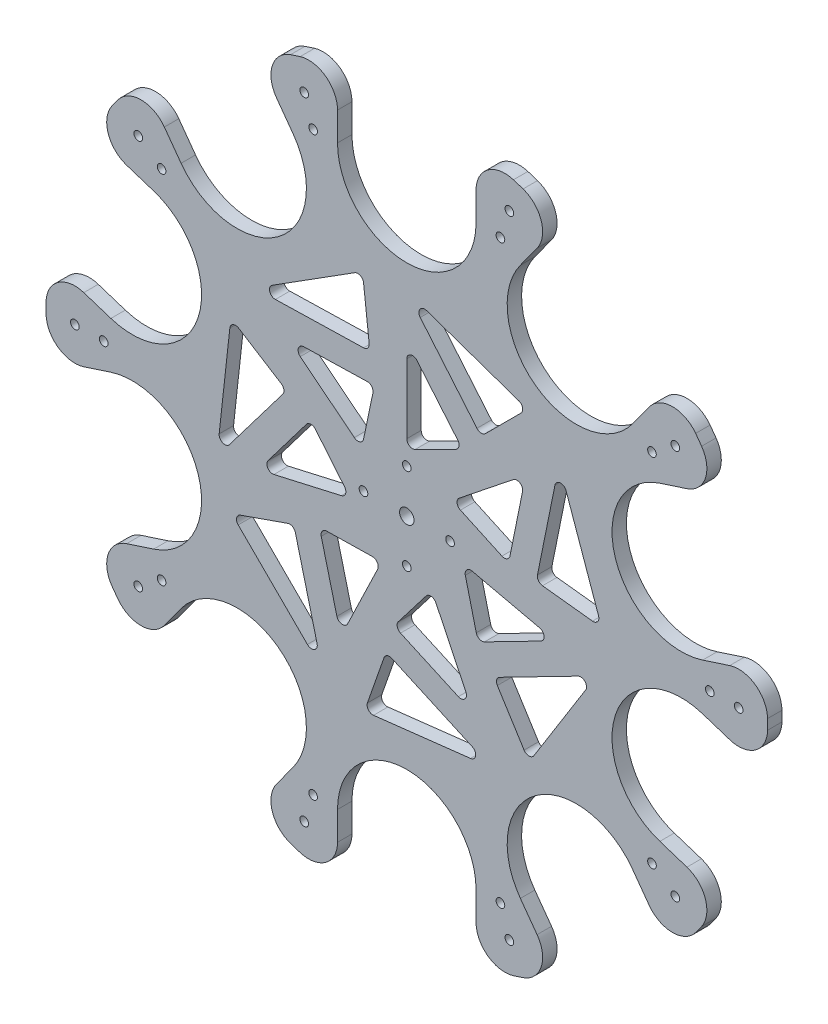
from build123d import *

# Parameters (mm, degrees)
EXTRUDE_1_DEPTH     = 5
CUT_EXTRUDE_2_DEPTH = 10


with BuildPart() as part:
    # 草图1 → 凸台-拉伸1 (new body)
    with BuildSketch(Plane.XY):
        with BuildLine():
            Line((-45.157092485, 102.984644478), (-39.362117364, 95.008545493))
            ThreePointArc((-39.362117364, 95.008545493), (-44.671679174, 61.485291572), (-78.194933094, 66.794853382))
            Line((-78.194933094, 66.794853382), (-83.989908215, 74.770952368))
            ThreePointArc((-83.989908215, 74.770952368), (-87.540173161, 77.803165087), (-92.080078159, 78.893099845))
            ThreePointArc((-92.080078159, 78.893099845), (-96.557407533, 77.83477316), (-100.087041477, 74.88380418))
            ThreePointArc((-100.087041477, 74.88380418), (-101.127124297, 73.473156537), (-102.147326663, 72.048064898))
            ThreePointArc((-102.147326663, 72.048064898), (-103.464208329, 63.127451833), (-97.065710474, 56.773654543))
            Line((-97.065710474, 56.773654543), (-87.689243765, 53.727055829))
            ThreePointArc((-87.689243765, 53.727055829), (-72.280295238, 23.485291572), (-102.522059495, 8.076343046))
            Line((-102.522059495, 8.076343046), (-111.898526204, 11.122941761))
            ThreePointArc((-111.898526204, 11.122941761), (-113.424351497, 11.489260004), (-114.988696148, 11.612376598))
            ThreePointArc((-114.988696148, 11.612376598), (-122.010018437, 8.732842405), (-124.987713204, 1.752583259))
            ThreePointArc((-124.987713204, 1.752583259), (-125, 0), (-124.987713204, -1.752583259))
            ThreePointArc((-124.987713204, -1.752583259), (-120.809688049, -9.743554451), (-111.898526204, -11.122941761))
            Line((-111.898526204, -11.122941761), (-102.522059495, -8.076343046))
            ThreePointArc((-102.522059495, -8.076343046), (-98.86007879, -7.197179263), (-95.10565163, -6.901699437))
            ThreePointArc((-95.10565163, -6.901699437), (-71.401131455, -27.147272277), (-87.689243765, -53.727055829))
            Line((-87.689243765, -53.727055829), (-97.065710474, -56.773654543))
            ThreePointArc((-97.065710474, -56.773654543), (-103.464208329, -63.127451833), (-102.147326663, -72.048064898))
            ThreePointArc((-102.147326663, -72.048064898), (-101.127124297, -73.473156537), (-100.087041477, -74.88380418))
            ThreePointArc((-100.087041477, -74.88380418), (-92.009973106, -78.892854106), (-83.989908215, -74.770952368))
            Line((-83.989908215, -74.770952368), (-78.194933094, -66.794853382))
            ThreePointArc((-78.194933094, -66.794853382), (-69.674297223, -59.517542857), (-58.778525229, -56.901699437))
            ThreePointArc((-58.778525229, -56.901699437), (-37.394368649, -70.005927444), (-39.362117364, -95.008545493))
            Line((-39.362117364, -95.008545493), (-45.157092485, -102.984644478))
            ThreePointArc((-45.157092485, -102.984644478), (-46.598917645, -111.88591714), (-40.290133197, -118.328801088))
            ThreePointArc((-40.290133197, -118.328801088), (-38.627124297, -118.882064537), (-36.956521739, -119.41195711))
            ThreePointArc((-36.956521739, -119.41195711), (-28.065575739, -117.907764962), (-24, -109.859000542))
            Line((-24, -109.859000542), (-24, -100))
            ThreePointArc((-24, -100), (-16.970562748, -83.029437252), (0, -76))
            ThreePointArc((0, -76), (16.970562748, -83.029437252), (24, -100))
            Line((24, -100), (24, -109.859000542))
            ThreePointArc((24, -109.859000542), (28.065575739, -117.907764962), (36.956521739, -119.41195711))
            ThreePointArc((36.956521739, -119.41195711), (38.627124297, -118.882064537), (40.290133197, -118.328801088))
            ThreePointArc((40.290133197, -118.328801088), (46.598917645, -111.88591714), (45.157092485, -102.984644478))
            Line((45.157092485, -102.984644478), (39.362117364, -95.008545493))
            ThreePointArc((39.362117364, -95.008545493), (37.394368649, -70.005927444), (58.778525229, -56.901699437))
            ThreePointArc((58.778525229, -56.901699437), (69.674297223, -59.517542857), (78.194933094, -66.794853382))
            Line((78.194933094, -66.794853382), (83.989908215, -74.770952368))
            ThreePointArc((83.989908215, -74.770952368), (92.009973106, -78.892854106), (100.087041477, -74.88380418))
            ThreePointArc((100.087041477, -74.88380418), (101.127124297, -73.473156537), (102.147326663, -72.048064898))
            ThreePointArc((102.147326663, -72.048064898), (103.464208329, -63.127451833), (97.065710474, -56.773654543))
            Line((97.065710474, -56.773654543), (87.689243765, -53.727055829))
            ThreePointArc((87.689243765, -53.727055829), (71.401131455, -27.147272277), (95.10565163, -6.901699437))
            ThreePointArc((95.10565163, -6.901699437), (98.86007879, -7.197179263), (102.522059495, -8.076343046))
            Line((102.522059495, -8.076343046), (111.898526204, -11.122941761))
            ThreePointArc((111.898526204, -11.122941761), (120.809688049, -9.743554451), (124.987713204, -1.752583259))
            ThreePointArc((124.987713204, -1.752583259), (125, 0), (124.987713204, 1.752583259))
            ThreePointArc((124.987713204, 1.752583259), (122.010018437, 8.732842405), (114.988696148, 11.612376598))
            ThreePointArc((114.988696148, 11.612376598), (113.424351497, 11.489260004), (111.898526204, 11.122941761))
            Line((111.898526204, 11.122941761), (102.522059495, 8.076343046))
            ThreePointArc((102.522059495, 8.076343046), (72.280295238, 23.485291572), (87.689243765, 53.727055829))
            Line((87.689243765, 53.727055829), (97.065710474, 56.773654543))
            ThreePointArc((97.065710474, 56.773654543), (103.464208329, 63.127451833), (102.147326663, 72.048064898))
            ThreePointArc((102.147326663, 72.048064898), (101.127124297, 73.473156537), (100.087041477, 74.88380418))
            ThreePointArc((100.087041477, 74.88380418), (96.557407533, 77.83477316), (92.080078159, 78.893099845))
            ThreePointArc((92.080078159, 78.893099845), (87.540173161, 77.803165087), (83.989908215, 74.770952368))
            Line((83.989908215, 74.770952368), (78.194933094, 66.794853382))
            ThreePointArc((78.194933094, 66.794853382), (44.671679174, 61.485291572), (39.362117364, 95.008545493))
            Line((39.362117364, 95.008545493), (45.157092485, 102.984644478))
            ThreePointArc((45.157092485, 102.984644478), (46.598917645, 111.88591714), (40.290133197, 118.328801088))
            ThreePointArc((40.290133197, 118.328801088), (38.627124297, 118.882064537), (36.956521739, 119.41195711))
            ThreePointArc((36.956521739, 119.41195711), (35.495064265, 119.746608081), (34, 119.859000542))
            ThreePointArc((34, 119.859000542), (26.928932188, 116.930068353), (24, 109.859000542))
            Line((24, 109.859000542), (24, 100))
            ThreePointArc((24, 100), (0, 76), (-24, 100))
            Line((-24, 100), (-24, 109.859000542))
            ThreePointArc((-24, 109.859000542), (-26.928932188, 116.930068353), (-34, 119.859000542))
            ThreePointArc((-34, 119.859000542), (-35.495064265, 119.746608081), (-36.956521739, 119.41195711))
            ThreePointArc((-36.956521739, 119.41195711), (-38.627124297, 118.882064537), (-40.290133197, 118.328801088))
            ThreePointArc((-40.290133197, 118.328801088), (-46.598917645, 111.88591714), (-45.157092485, 102.984644478))
        make_face()
        with BuildLine():
            ThreePointArc((-105, 1.5), (-106.5, 0), (-105, -1.5))
            ThreePointArc((-105, -1.5), (-103.5, 0), (-105, 1.5))
        make_face(mode=Mode.SUBTRACT)
        with BuildLine():
            ThreePointArc((-115, 1.5), (-116.5, 0), (-115, -1.5))
            ThreePointArc((-115, -1.5), (-113.5, 0), (-115, 1.5))
        make_face(mode=Mode.SUBTRACT)
        with BuildLine():
            ThreePointArc((0, 2.5), (-2.5, 0), (0, -2.5))
            ThreePointArc((0, -2.5), (2.5, 0), (0, 2.5))
        make_face(mode=Mode.SUBTRACT)
        with BuildLine():
            ThreePointArc((-84.065106531, 62.930976982), (-86.160309901, 62.599129369), (-85.828462288, 60.503925999))
            ThreePointArc((-85.828462288, 60.503925999), (-83.733258918, 60.835773612), (-84.065106531, 62.930976982))
        make_face(mode=Mode.SUBTRACT)
        with BuildLine():
            ThreePointArc((-92.155276475, 68.808829505), (-94.250479845, 68.476981892), (-93.918632232, 66.381778522))
            ThreePointArc((-93.918632232, 66.381778522), (-91.823428862, 66.713626135), (-92.155276475, 68.808829505))
        make_face(mode=Mode.SUBTRACT)
        with BuildLine():
            ThreePointArc((-31.020199635, 100.324459703), (-32.910309901, 101.287518985), (-33.873369184, 99.397408719))
            ThreePointArc((-33.873369184, 99.397408719), (-31.983258918, 98.434349437), (-31.020199635, 100.324459703))
        make_face(mode=Mode.SUBTRACT)
        with BuildLine():
            ThreePointArc((-34.110369579, 109.835024866), (-36.000479845, 110.798084148), (-36.963539128, 108.907973882))
            ThreePointArc((-36.963539128, 108.907973882), (-35.073428862, 107.9449146), (-34.110369579, 109.835024866))
        make_face(mode=Mode.SUBTRACT)
        with BuildLine():
            ThreePointArc((33.873369184, 99.397408719), (32.910309901, 101.287518985), (31.020199635, 100.324459703))
            ThreePointArc((31.020199635, 100.324459703), (31.983258918, 98.434349437), (33.873369184, 99.397408719))
        make_face(mode=Mode.SUBTRACT)
        with BuildLine():
            ThreePointArc((36.963539128, 108.907973882), (36.000479845, 110.798084148), (34.110369579, 109.835024866))
            ThreePointArc((34.110369579, 109.835024866), (35.073428862, 107.944914599), (36.963539128, 108.907973882))
        make_face(mode=Mode.SUBTRACT)
        with BuildLine():
            ThreePointArc((85.828462288, 60.503925999), (86.160309901, 62.599129369), (84.065106531, 62.930976982))
            ThreePointArc((84.065106531, 62.930976982), (83.733258918, 60.835773612), (85.828462288, 60.503925999))
        make_face(mode=Mode.SUBTRACT)
        with BuildLine():
            ThreePointArc((93.918632232, 66.381778522), (94.250479845, 68.476981892), (92.155276475, 68.808829505))
            ThreePointArc((92.155276475, 68.808829505), (91.823428862, 66.713626135), (93.918632232, 66.381778522))
        make_face(mode=Mode.SUBTRACT)
        with BuildLine():
            ThreePointArc((105, -1.5), (106.5, 0), (105, 1.5))
            ThreePointArc((105, 1.5), (103.5, 0), (105, -1.5))
        make_face(mode=Mode.SUBTRACT)
        with BuildLine():
            ThreePointArc((115, -1.5), (116.5, 0), (115, 1.5))
            ThreePointArc((115, 1.5), (113.5, 0), (115, -1.5))
        make_face(mode=Mode.SUBTRACT)
        with BuildLine():
            ThreePointArc((84.065106531, -62.930976982), (86.160309901, -62.599129369), (85.828462288, -60.503925999))
            ThreePointArc((85.828462288, -60.503925999), (83.733258918, -60.835773612), (84.065106531, -62.930976982))
        make_face(mode=Mode.SUBTRACT)
        with BuildLine():
            ThreePointArc((92.155276475, -68.808829505), (94.250479845, -68.476981892), (93.918632232, -66.381778522))
            ThreePointArc((93.918632232, -66.381778522), (91.823428862, -66.713626135), (92.155276475, -68.808829505))
        make_face(mode=Mode.SUBTRACT)
        with BuildLine():
            ThreePointArc((31.020199635, -100.324459703), (32.910309901, -101.287518985), (33.873369184, -99.397408719))
            ThreePointArc((33.873369184, -99.397408719), (31.983258918, -98.434349437), (31.020199635, -100.324459703))
        make_face(mode=Mode.SUBTRACT)
        with BuildLine():
            ThreePointArc((34.110369579, -109.835024866), (36.000479845, -110.798084148), (36.963539128, -108.907973882))
            ThreePointArc((36.963539128, -108.907973882), (35.073428862, -107.9449146), (34.110369579, -109.835024866))
        make_face(mode=Mode.SUBTRACT)
        with BuildLine():
            ThreePointArc((-33.873369184, -99.397408719), (-32.910309901, -101.287518985), (-31.020199635, -100.324459703))
            ThreePointArc((-31.020199635, -100.324459703), (-31.983258918, -98.434349437), (-33.873369184, -99.397408719))
        make_face(mode=Mode.SUBTRACT)
        with BuildLine():
            ThreePointArc((-36.963539128, -108.907973882), (-36.000479845, -110.798084148), (-34.110369579, -109.835024866))
            ThreePointArc((-34.110369579, -109.835024866), (-35.073428862, -107.944914599), (-36.963539128, -108.907973882))
        make_face(mode=Mode.SUBTRACT)
        with BuildLine():
            ThreePointArc((-85.828462288, -60.503925999), (-86.160309901, -62.599129369), (-84.065106531, -62.930976982))
            ThreePointArc((-84.065106531, -62.930976982), (-83.733258918, -60.835773612), (-85.828462288, -60.503925999))
        make_face(mode=Mode.SUBTRACT)
        with BuildLine():
            ThreePointArc((-93.918632232, -66.381778522), (-94.250479845, -68.476981892), (-92.155276475, -68.808829505))
            ThreePointArc((-92.155276475, -68.808829505), (-91.823428862, -66.713626135), (-93.918632232, -66.381778522))
        make_face(mode=Mode.SUBTRACT)
        with BuildLine():
            ThreePointArc((15, 1.5), (13.5, 0), (15, -1.5))
            ThreePointArc((15, -1.5), (16.5, 0), (15, 1.5))
        make_face(mode=Mode.SUBTRACT)
        with BuildLine():
            ThreePointArc((0, -16.5), (1.5, -15), (0, -13.5))
            ThreePointArc((0, -13.5), (-1.5, -15), (0, -16.5))
        make_face(mode=Mode.SUBTRACT)
        with BuildLine():
            ThreePointArc((-15, 1.5), (-16.5, 0), (-15, -1.5))
            ThreePointArc((-15, -1.5), (-13.5, 0), (-15, 1.5))
        make_face(mode=Mode.SUBTRACT)
        with BuildLine():
            ThreePointArc((0, 16.5), (-1.5, 15), (0, 13.5))
            ThreePointArc((0, 13.5), (1.5, 15), (0, 16.5))
        make_face(mode=Mode.SUBTRACT)
    extrude(amount=EXTRUDE_1_DEPTH)

    # 草图2 → 切除-拉伸2 (cut)
    with BuildSketch(Plane.XY.offset(5)):
        with BuildLine():
            Line((2.899798849, 21.460808619), (17.027519589, 28.577818209))
            ThreePointArc((17.027519589, 28.577818209), (18.086650661, 29.960747739), (17.659809626, 31.649551885))
            Line((17.659809626, 31.649551885), (3.532088886, 48.486313832))
            ThreePointArc((3.532088886, 48.486313832), (1.315959713, 49.080123854), (0, 47.200738613))
            Line((0, 47.200738613), (0, 23.246967075))
            ThreePointArc((0, 23.246967075), (0.951095261, 21.544087499), (2.899798849, 21.460808619))
        make_face()
        with BuildLine():
            Line((4.658859392, 61.947787582), (24.308545222, 38.530203901))
            ThreePointArc((24.308545222, 38.530203901), (25.753395333, 37.817682677), (27.25484767, 38.401565558))
            Line((27.25484767, 38.401565558), (39.573073075, 50.719790962))
            ThreePointArc((39.573073075, 50.719790962), (40.108175806, 52.581403659), (38.814850669, 54.023363041))
            Line((38.814850669, 54.023363041), (6.846939435, 65.122721318))
            ThreePointArc((6.846939435, 65.122721318), (4.544152036, 64.368291053), (4.658859392, 61.947787582))
        make_face()
        with BuildLine():
            Line((18.586730827, 11.11344128), (32.959522791, 4.505327329))
            ThreePointArc((32.959522791, 4.505327329), (34.701098057, 4.539507773), (35.755327274, 5.926177693))
            Line((35.755327274, 5.926177693), (40.110348023, 27.469223914))
            ThreePointArc((40.110348023, 27.469223914), (39.192873454, 29.572097964), (36.903023443, 29.429179165))
            Line((36.903023443, 29.429179165), (18.175210731, 14.494246895))
            ThreePointArc((18.175210731, 14.494246895), (17.436844064, 12.688922628), (18.586730827, 11.11344128))
        make_face()
        with BuildLine():
            Line((51.33748192, 34.981370861), (45.28025648, 5.018003249))
            ThreePointArc((45.28025648, 5.018003249), (45.624034265, 3.444124227), (47.016672503, 2.634286542))
            Line((47.016672503, 2.634286542), (64.327736849, 0.68379803))
            ThreePointArc((64.327736849, 0.68379803), (66.11683536, 1.426134399), (66.437829567, 3.336343677))
            Line((66.437829567, 3.336343677), (55.183990662, 35.250199802))
            ThreePointArc((55.183990662, 35.250199802), (53.158388871, 36.580211912), (51.33748192, 34.981370861))
        make_face()
        with BuildLine():
            Line((20.277475392, -7.602574015), (24.072333079, -22.959766921))
            ThreePointArc((24.072333079, -22.959766921), (25.184910844, -24.300074136), (26.926354209, -24.259729173))
            Line((26.926354209, -24.259729173), (46.484696996, -14.232751882))
            ThreePointArc((46.484696996, -14.232751882), (47.556754094, -12.204320855), (46.017317549, -10.50315244))
            Line((46.017317549, -10.50315244), (22.664117075, -5.172936825))
            ThreePointArc((22.664117075, -5.172936825), (20.79229364, -5.721259789), (20.277475392, -7.602574015))
        make_face()
        with BuildLine():
            Line((59.357933469, -18.326731609), (32.155011059, -32.272856199))
            ThreePointArc((32.155011059, -32.272856199), (31.138844834, -33.522930013), (31.373983976, -35.11666397))
            Line((31.373983976, -35.11666397), (40.642302729, -49.867108766))
            ThreePointArc((40.642302729, -49.867108766), (42.33816935, -50.803043151), (44.031767716, -49.863010524))
            Line((44.031767716, -49.863010524), (61.966371372, -21.166441138))
            ThreePointArc((61.966371372, -21.166441138), (61.743274652, -18.753512899), (59.357933469, -18.326731609))
        make_face()
        with BuildLine():
            Line((6.698867402, -20.593696013), (-2.941814427, -33.135688386))
            ThreePointArc((-2.941814427, -33.135688386), (-3.296027914, -34.841204589), (-2.178712773, -36.177565164))
            Line((-2.178712773, -36.177565164), (17.855121016, -45.217175215))
            ThreePointArc((17.855121016, -45.217175215), (20.109428921, -44.790637146), (20.479632958, -42.526396032))
            Line((20.479632958, -42.526396032), (10.086480998, -20.944793608))
            ThreePointArc((10.086480998, -20.944793608), (8.490722019, -19.823216893), (6.698867402, -20.593696013))
        make_face()
        with BuildLine():
            Line((22.680650434, -57.83443138), (-5.183613531, -45.261596682))
            ThreePointArc((-5.183613531, -45.261596682), (-6.794529873, -45.246534211), (-7.893954398, -46.424050263))
            Line((-7.893954398, -46.424050263), (-13.647614297, -62.867065558))
            ThreePointArc((-13.647614297, -62.867065558), (-13.322001722, -64.776493016), (-11.53111331, -65.514500781))
            Line((-11.53111331, -65.514500781), (22.086810555, -61.644320184))
            ThreePointArc((22.086810555, -61.644320184), (23.834215288, -59.965459996), (22.680650434, -57.83443138))
        make_face()
        with BuildLine():
            Line((-11.924124374, -18.077344878), (-27.740715668, -18.359760652))
            ThreePointArc((-27.740715668, -18.359760652), (-29.294990426, -19.146197355), (-29.6431646, -20.852956698))
            Line((-29.6431646, -20.852956698), (-24.219725267, -42.152143349))
            ThreePointArc((-24.219725267, -42.152143349), (-22.480706387, -43.648690105), (-20.479632958, -42.526396032))
            Line((-20.479632958, -42.526396032), (-10.086480998, -20.944793608))
            ThreePointArc((-10.086480998, -20.944793608), (-10.204536461, -18.997887356), (-11.924124374, -18.077344878))
        make_face()
        with BuildLine():
            Line((-31.075624978, -53.791624714), (-38.618871406, -24.167431696))
            ThreePointArc((-38.618871406, -24.167431696), (-39.611485003, -22.898575286), (-41.217584103, -22.77317983))
            Line((-41.217584103, -22.77317983), (-57.660599397, -28.52683973))
            ThreePointArc((-57.660599397, -28.52683973), (-58.950433778, -29.97192244), (-58.410830821, -31.832235697))
            Line((-58.410830821, -31.832235697), (-34.424569098, -55.702768817))
            ThreePointArc((-34.424569098, -55.702768817), (-32.022494318, -56.022192643), (-31.075624978, -53.791624714))
        make_face()
        with BuildLine():
            Line((-21.568007289, -1.94838434), (-31.650292203, 10.241441325))
            ThreePointArc((-31.650292203, 10.241441325), (-33.234227638, 10.966286998), (-34.785708872, 10.174353484))
            Line((-34.785708872, 10.174353484), (-48.056624431, -7.345687795))
            ThreePointArc((-48.056624431, -7.345687795), (-48.142411263, -9.638389143), (-46.017317549, -10.50315244))
            Line((-46.017317549, -10.50315244), (-22.664117075, -5.172936825))
            ThreePointArc((-22.664117075, -5.172936825), (-21.215570851, -3.866761154), (-21.568007289, -1.94838434))
        make_face()
        with BuildLine():
            Line((-61.431320955, -9.242627489), (-42.973331431, 15.125302284))
            ThreePointArc((-42.973331431, 15.125302284), (-42.600183998, 16.692477874), (-43.503532293, 18.026359503))
            Line((-43.503532293, 18.026359503), (-58.253977089, 27.294678256))
            ThreePointArc((-58.253977089, 27.294678256), (-60.187986829, 27.402117049), (-61.306001361, 25.820352125))
            Line((-61.306001361, 25.820352125), (-65.013546088, -7.815896401))
            ThreePointArc((-65.013546088, -7.815896401), (-63.765612563, -9.893071586), (-61.431320955, -9.242627489))
        make_face()
        with BuildLine():
            Line((-14.970740807, 15.647749347), (-11.726553161, 31.130629096))
            ThreePointArc((-11.726553161, 31.130629096), (-12.147413584, 32.82093357), (-13.733904865, 33.540167974))
            Line((-13.733904865, 33.540167974), (-35.705905223, 32.992220494))
            ThreePointArc((-35.705905223, 32.992220494), (-37.551898532, 31.629815431), (-36.903023443, 29.429179165))
            Line((-36.903023443, 29.429179165), (-18.175210731, 14.494246895))
            ThreePointArc((-18.175210731, 14.494246895), (-16.250847672, 14.176115064), (-14.970740807, 15.647749347))
        make_face()
        with BuildLine():
            Line((-45.527979282, 42.26625675), (-14.967996392, 43.028375143))
            ThreePointArc((-14.967996392, 43.028375143), (-13.510075558, 43.713754731), (-13.030433356, 45.25168246))
            Line((-13.030433356, 45.25168246), (-14.980921868, 62.562746805))
            ThreePointArc((-14.980921868, 62.562746805), (-16.102758187, 64.141803499), (-18.036502461, 64.029688159))
            Line((-18.036502461, 64.029688159), (-46.645996838, 45.95650542))
            ThreePointArc((-46.645996838, 45.95650542), (-47.491923966, 43.685734158), (-45.527979282, 42.26625675))
        make_face()
    extrude(amount=-CUT_EXTRUDE_2_DEPTH, mode=Mode.SUBTRACT)


solid = part.part
